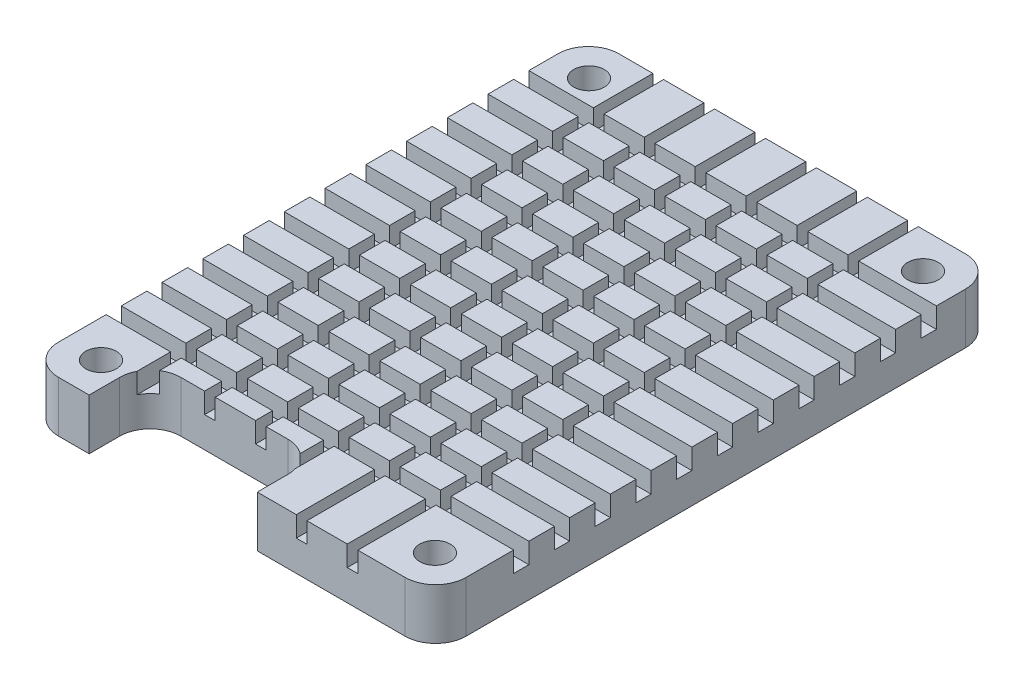
from build123d import *

# Parameters (mm, degrees)
SKETCH1_W           = 40
SKETCH1_H           = 55
BOSS_EXTRUDE1_DEPTH = 5
SKETCH2_R           = 1.5
SKETCH2_W           = 16.5
SKETCH2_H           = 6
CUT_EXTRUDE1_DEPTH  = 69.190908485
FILLET1_R           = 3
SKETCH3_W           = 40
SKETCH3_H           = 1.489318348
SKETCH3_W_2         = 1.043967118
SKETCH3_H_2         = 55
CUT_EXTRUDE2_DEPTH  = 2


with BuildPart() as part:
    # Sketch1 → Boss-Extrude1 (new body)
    with BuildSketch(Plane(origin=(0, 0, 0), x_dir=(1, 0, 0), z_dir=(0, 1, 0))):
        with Locations((20, 27.5)):
            Rectangle(SKETCH1_W, SKETCH1_H)
    extrude(amount=BOSS_EXTRUDE1_DEPTH)

    # Sketch2 → Cut-Extrude1 (cut, through all)
    with BuildSketch(Plane(origin=(0, 5, 0), x_dir=(1, 0, 0), z_dir=(0, 1, 0))):
        with Locations(Location((3.611133572, 51.446838809, 0), (0, 0, 270))):
            Circle(SKETCH2_R)
        with Locations(Location((36.388866428, 51.446838809, 0), (0, 0, 270))):
            Circle(SKETCH2_R)
        with Locations(Location((36.388866428, 3.553161191, 0), (0, 0, 270))):
            Circle(SKETCH2_R)
        with Locations(Location((3.611133572, 3.553161191, 0), (0, 0, 270))):
            Circle(SKETCH2_R)
        with Locations((14.25, 3)):
            Rectangle(SKETCH2_W, SKETCH2_H)
    extrude(amount=-CUT_EXTRUDE1_DEPTH, mode=Mode.SUBTRACT)

    # Fillet1
    fillet1_edges = [part.edges().sort_by_distance(p)[0] for p in [
        (6, 2.5, -6),
        (22.5, 2.5, -6),
        (0, 2.5, -55),
        (40, 2.5, -55),
        (40, 2.5, 0),
        (0, 2.5, 0),
    ]]
    fillet(fillet1_edges, radius=FILLET1_R)

    # Sketch3 → Cut-Extrude2 (cut)
    with BuildSketch(Plane(origin=(0, 5, 0), x_dir=(1, 0, 0), z_dir=(0, 1, 0))):
        with Locations((20, 48.407738336)):
            Rectangle(SKETCH3_W, SKETCH3_H)
        with Locations((20, 44.407738336)):
            Rectangle(SKETCH3_W, SKETCH3_H)
        with Locations((20, 40.407738336)):
            Rectangle(SKETCH3_W, SKETCH3_H)
        with Locations((20, 36.407738336)):
            Rectangle(SKETCH3_W, SKETCH3_H)
        with Locations((20, 32.407738336)):
            Rectangle(SKETCH3_W, SKETCH3_H)
        with Locations((20, 28.407738336)):
            Rectangle(SKETCH3_W, SKETCH3_H)
        with Locations((20, 24.407738336)):
            Rectangle(SKETCH3_W, SKETCH3_H)
        with Locations((20, 20.407738336)):
            Rectangle(SKETCH3_W, SKETCH3_H)
        with Locations((20, 16.407738336)):
            Rectangle(SKETCH3_W, SKETCH3_H)
        with Locations((20, 12.407738336)):
            Rectangle(SKETCH3_W, SKETCH3_H)
        with Locations((20, 8.407738336)):
            Rectangle(SKETCH3_W, SKETCH3_H)
        with Locations((6.852462107, 27.5)):
            Rectangle(SKETCH3_W_2, SKETCH3_H_2)
        with Locations((11.852462107, 27.5)):
            Rectangle(SKETCH3_W_2, SKETCH3_H_2)
        with Locations((16.852462107, 27.5)):
            Rectangle(SKETCH3_W_2, SKETCH3_H_2)
        with Locations((21.852462107, 27.5)):
            Rectangle(SKETCH3_W_2, SKETCH3_H_2)
        with Locations((26.852462107, 27.5)):
            Rectangle(SKETCH3_W_2, SKETCH3_H_2)
        with Locations((31.852462107, 27.5)):
            Rectangle(SKETCH3_W_2, SKETCH3_H_2)
    extrude(amount=-CUT_EXTRUDE2_DEPTH, mode=Mode.SUBTRACT)


solid = part.part
